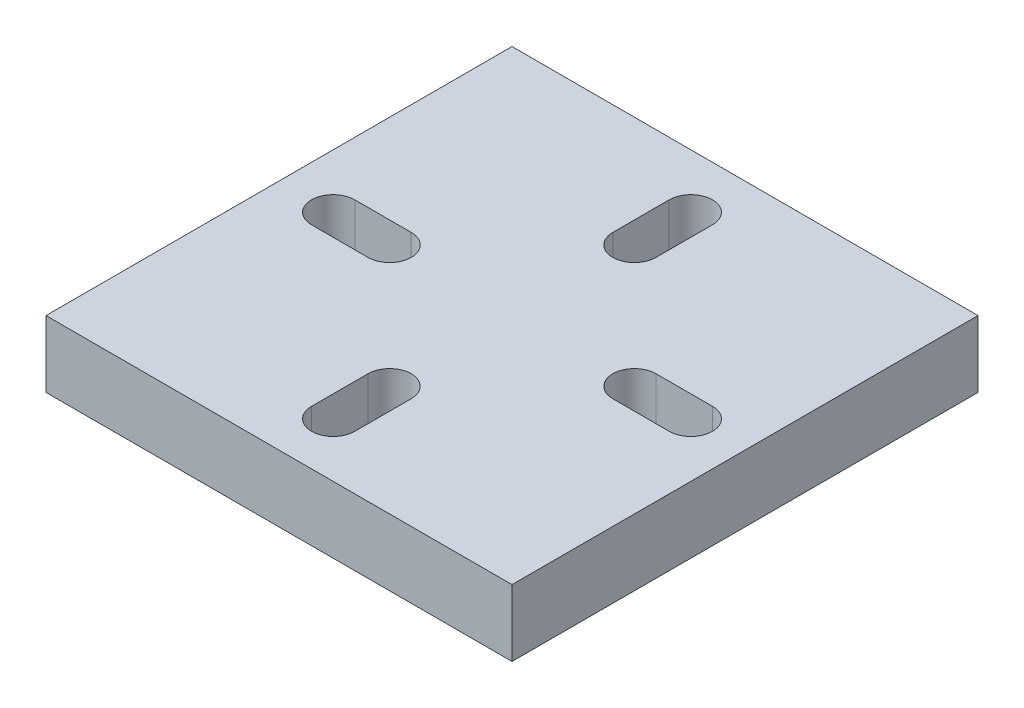
from build123d import *

# Parameters (mm, degrees)
SKETCH1_W           = 70
SKETCH1_H           = 70
BOSS_EXTRUDE1_DEPTH = 10
CUT_EXTRUDE1_DEPTH  = 51.497524692


with BuildPart() as part:
    # Sketch1 → Boss-Extrude1 (new body)
    with BuildSketch(Plane(origin=(0, 0, 0), x_dir=(1, 0, 0), z_dir=(0, 1, 0))):
        Rectangle(SKETCH1_W, SKETCH1_H)
    extrude(amount=BOSS_EXTRUDE1_DEPTH)

    # Sketch4 → Cut-Extrude1 (cut, through all)
    with BuildSketch(Plane(origin=(0, 10, 0), x_dir=(1, 0, 0), z_dir=(0, 1, 0))):
        with BuildLine():
            Line((-26.870057685, 3.25), (-18.384776311, 3.25))
            ThreePointArc((-18.384776311, 3.25), (-15.134776311, 0), (-18.384776311, -3.25))
            Line((-18.384776311, -3.25), (-26.870057685, -3.25))
            ThreePointArc((-26.870057685, -3.25), (-30.120057685, 0), (-26.870057685, 3.25))
        make_face()
        with BuildLine():
            Line((3.25, 26.870057685), (3.25, 18.384776311))
            ThreePointArc((3.25, 18.384776311), (0, 15.134776311), (-3.25, 18.384776311))
            Line((-3.25, 18.384776311), (-3.25, 26.870057685))
            ThreePointArc((-3.25, 26.870057685), (0, 30.120057685), (3.25, 26.870057685))
        make_face()
        with BuildLine():
            Line((26.870057685, -3.25), (18.384776311, -3.25))
            ThreePointArc((18.384776311, -3.25), (15.134776311, 0), (18.384776311, 3.25))
            Line((18.384776311, 3.25), (26.870057685, 3.25))
            ThreePointArc((26.870057685, 3.25), (30.120057685, 0), (26.870057685, -3.25))
        make_face()
        with BuildLine():
            Line((-3.25, -26.870057685), (-3.25, -18.384776311))
            ThreePointArc((-3.25, -18.384776311), (0, -15.134776311), (3.25, -18.384776311))
            Line((3.25, -18.384776311), (3.25, -26.870057685))
            ThreePointArc((3.25, -26.870057685), (0, -30.120057685), (-3.25, -26.870057685))
        make_face()
    extrude(amount=-CUT_EXTRUDE1_DEPTH, mode=Mode.SUBTRACT)


solid = part.part
